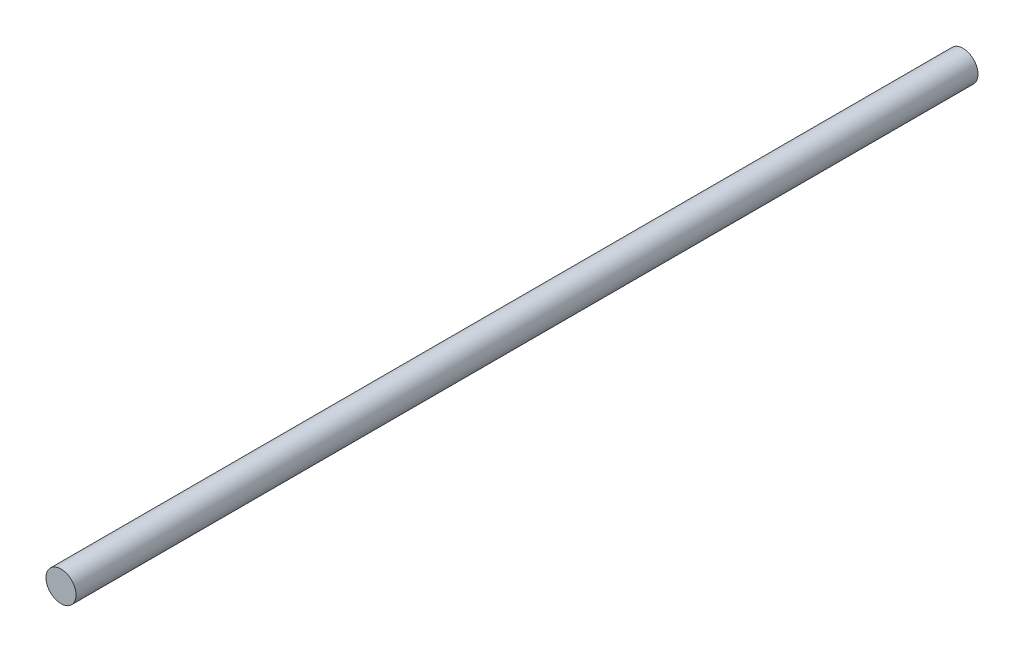
from build123d import *

# Parameters (mm, degrees)
ESQUISSE1_R        = 2.5
BOSS_EXTRU_1_DEPTH = 150


with BuildPart() as part:
    # Esquisse1 → Boss.-Extru.1 (new body)
    with BuildSketch(Plane.XY):
        Circle(ESQUISSE1_R)
    extrude(amount=BOSS_EXTRU_1_DEPTH)


solid = part.part
